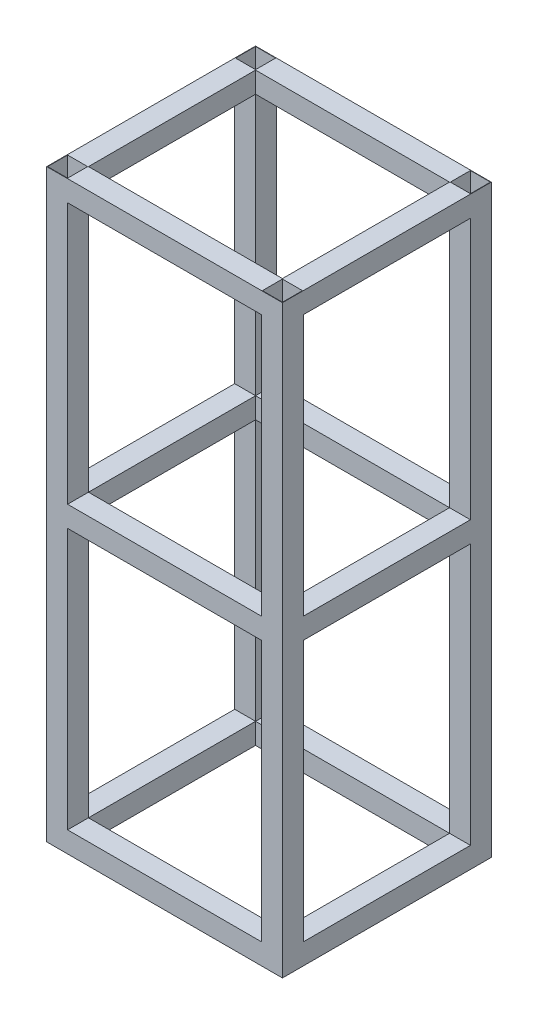
from build123d import *

# Parameters (mm, degrees)
BOSS_EXTRUDE1_START  = -2177.712701274
SKETCH1_W            = 155.425402548
SKETCH1_H            = 155.425402548
SKETCH1_W_2          = 149.425402548
SKETCH1_H_2          = 149.425402548
BOSS_EXTRUDE1_DEPTH  = 4355.425402548
BOSS_EXTRUDE2_START  = -2177.712701274
SKETCH2_W            = 155.425402548
SKETCH2_H            = 155.425402548
SKETCH2_W_2          = 149.425402548
SKETCH2_H_2          = 149.425402548
BOSS_EXTRUDE2_DEPTH  = 4355.425402548
BOSS_EXTRUDE3_START  = -2177.712701274
SKETCH3_W            = 155.425402548
SKETCH3_H            = 155.425402548
SKETCH3_W_2          = 149.425402548
SKETCH3_H_2          = 149.425402548
BOSS_EXTRUDE3_DEPTH  = 4355.425402548
BOSS_EXTRUDE4_START  = -2177.712701274
SKETCH4_W            = 155.425402548
SKETCH4_H            = 155.425402548
SKETCH4_W_2          = 149.425402548
SKETCH4_H_2          = 149.425402548
BOSS_EXTRUDE4_DEPTH  = 4355.425402548
BOSS_EXTRUDE5_START  = -722.287298726
SKETCH5_W            = 155.425402548
SKETCH5_H            = 155.425402548
SKETCH5_W_2          = 149.425402548
SKETCH5_H_2          = 149.425402548
BOSS_EXTRUDE5_DEPTH  = 1444.574597452
BOSS_EXTRUDE6_START  = -722.287298726
SKETCH6_W            = 155.425402548
SKETCH6_H            = 155.425402548
SKETCH6_W_2          = 149.425402548
SKETCH6_H_2          = 149.425402548
BOSS_EXTRUDE6_DEPTH  = 1444.574597452
BOSS_EXTRUDE7_START  = -622.287298726
SKETCH7_W            = 155.425402548
SKETCH7_H            = 155.425402548
SKETCH7_W_2          = 149.425402548
SKETCH7_H_2          = 149.425402548
BOSS_EXTRUDE7_DEPTH  = 1244.574597452
BOSS_EXTRUDE8_START  = -622.287298726
SKETCH8_W            = 155.425402548
SKETCH8_H            = 155.425402548
SKETCH8_W_2          = 149.425402548
SKETCH8_H_2          = 149.425402548
BOSS_EXTRUDE8_DEPTH  = 1244.574597452
BOSS_EXTRUDE9_START  = -722.287298726
SKETCH9_W            = 155.425402548
SKETCH9_H            = 155.425402548
SKETCH9_W_2          = 149.425402548
SKETCH9_H_2          = 149.425402548
BOSS_EXTRUDE9_DEPTH  = 1444.574597452
BOSS_EXTRUDE10_START = -722.287298726
SKETCH10_W           = 155.425402548
SKETCH10_H           = 155.425402548
SKETCH10_W_2         = 149.425402548
SKETCH10_H_2         = 149.425402548
BOSS_EXTRUDE10_DEPTH = 1444.574597452
BOSS_EXTRUDE11_START = -622.287298726
SKETCH11_W           = 155.425402548
SKETCH11_H           = 155.425402548
SKETCH11_W_2         = 149.425402548
SKETCH11_H_2         = 149.425402548
BOSS_EXTRUDE11_DEPTH = 1244.574597452
BOSS_EXTRUDE12_START = -622.287298726
SKETCH12_W           = 155.425402548
SKETCH12_H           = 155.425402548
SKETCH12_W_2         = 149.425402548
SKETCH12_H_2         = 149.425402548
BOSS_EXTRUDE12_DEPTH = 1244.574597452
BOSS_EXTRUDE13_START = -722.287298726
SKETCH13_W           = 155.425402548
SKETCH13_H           = 155.425402548
SKETCH13_W_2         = 149.425402548
SKETCH13_H_2         = 149.425402548
BOSS_EXTRUDE13_DEPTH = 1444.574597452
BOSS_EXTRUDE14_START = -722.287298726
SKETCH14_W           = 155.425402548
SKETCH14_H           = 155.425402548
SKETCH14_W_2         = 149.425402548
SKETCH14_H_2         = 149.425402548
BOSS_EXTRUDE14_DEPTH = 1444.574597452
BOSS_EXTRUDE15_START = -622.287298726
SKETCH15_W           = 155.425402548
SKETCH15_H           = 155.425402548
SKETCH15_W_2         = 149.425402548
SKETCH15_H_2         = 149.425402548
BOSS_EXTRUDE15_DEPTH = 1244.574597452
BOSS_EXTRUDE16_START = -622.287298726
SKETCH16_W           = 155.425402548
SKETCH16_H           = 155.425402548
SKETCH16_W_2         = 149.425402548
SKETCH16_H_2         = 149.425402548
BOSS_EXTRUDE16_DEPTH = 1244.574597452


with BuildPart() as part:
    # Sketch1 → Boss-Extrude1 (new body)
    with BuildSketch(Plane(origin=(0, 0, 0), x_dir=(1, 0, 0), z_dir=(0, 1, 0)).offset(BOSS_EXTRUDE1_START)):
        with Locations((-800, 700)):
            Rectangle(SKETCH1_W, SKETCH1_H)
        with Locations((-800, 700)):
            Rectangle(SKETCH1_W_2, SKETCH1_H_2, mode=Mode.SUBTRACT)
    extrude(amount=BOSS_EXTRUDE1_DEPTH)



with BuildPart() as body_2:
    # Sketch2 → Boss-Extrude2 (new body)
    with BuildSketch(Plane(origin=(0, 0, 0), x_dir=(1, 0, 0), z_dir=(0, 1, 0)).offset(BOSS_EXTRUDE2_START)):
        with Locations((-800, -700)):
            Rectangle(SKETCH2_W, SKETCH2_H)
        with Locations((-800, -700)):
            Rectangle(SKETCH2_W_2, SKETCH2_H_2, mode=Mode.SUBTRACT)
    extrude(amount=BOSS_EXTRUDE2_DEPTH)



with BuildPart() as body_3:
    # Sketch3 → Boss-Extrude3 (new body)
    with BuildSketch(Plane(origin=(0, 0, 0), x_dir=(1, 0, 0), z_dir=(0, 1, 0)).offset(BOSS_EXTRUDE3_START)):
        with Locations((800, 700)):
            Rectangle(SKETCH3_W, SKETCH3_H)
        with Locations((800, 700)):
            Rectangle(SKETCH3_W_2, SKETCH3_H_2, mode=Mode.SUBTRACT)
    extrude(amount=BOSS_EXTRUDE3_DEPTH)


with BuildPart() as body_4:
    # Sketch4 → Boss-Extrude4 (new body)
    with BuildSketch(Plane(origin=(0, 0, 0), x_dir=(1, 0, 0), z_dir=(0, 1, 0)).offset(BOSS_EXTRUDE4_START)):
        with Locations((800, -700)):
            Rectangle(SKETCH4_W, SKETCH4_H)
        with Locations((800, -700)):
            Rectangle(SKETCH4_W_2, SKETCH4_H_2, mode=Mode.SUBTRACT)
    extrude(amount=BOSS_EXTRUDE4_DEPTH)


with BuildPart() as part_1:
    add(part.part)

    add(body_3.part)  # Boss-Extrude5 merges body 3
    # Sketch5 → Boss-Extrude5 (add)
    with BuildSketch(Plane(origin=(0, 0, 0), x_dir=(0, 0, -1), z_dir=(1, 0, 0)).offset(BOSS_EXTRUDE5_START)):
        with Locations((700, -2100)):
            Rectangle(SKETCH5_W, SKETCH5_H)
        with Locations((700, -2100)):
            Rectangle(SKETCH5_W_2, SKETCH5_H_2, mode=Mode.SUBTRACT)
    extrude(amount=BOSS_EXTRUDE5_DEPTH)



with BuildPart() as body_2_1:
    add(body_2.part)

    add(body_4.part)  # Boss-Extrude6 merges body 4
    # Sketch6 → Boss-Extrude6 (add)
    with BuildSketch(Plane(origin=(0, 0, 0), x_dir=(0, 0, -1), z_dir=(1, 0, 0)).offset(BOSS_EXTRUDE6_START)):
        with Locations((-700, -2100)):
            Rectangle(SKETCH6_W, SKETCH6_H)
        with Locations((-700, -2100)):
            Rectangle(SKETCH6_W_2, SKETCH6_H_2, mode=Mode.SUBTRACT)
    extrude(amount=BOSS_EXTRUDE6_DEPTH)


with BuildPart() as part_2:
    add(part_1.part)

    add(body_2_1.part)  # Boss-Extrude7 merges body 2
    # Sketch7 → Boss-Extrude7 (add)
    with BuildSketch(Plane.XY.offset(BOSS_EXTRUDE7_START)):
        with Locations((-800, -2100)):
            Rectangle(SKETCH7_W, SKETCH7_H)
        with Locations((-800, -2100)):
            Rectangle(SKETCH7_W_2, SKETCH7_H_2, mode=Mode.SUBTRACT)
    extrude(amount=BOSS_EXTRUDE7_DEPTH)

    # Sketch8 → Boss-Extrude8 (add)
    with BuildSketch(Plane.XY.offset(BOSS_EXTRUDE8_START)):
        with Locations((800, -2100)):
            Rectangle(SKETCH8_W, SKETCH8_H)
        with Locations((800, -2100)):
            Rectangle(SKETCH8_W_2, SKETCH8_H_2, mode=Mode.SUBTRACT)
    extrude(amount=BOSS_EXTRUDE8_DEPTH)

    # Sketch9 → Boss-Extrude9 (add)
    with BuildSketch(Plane(origin=(0, 0, 0), x_dir=(0, 0, -1), z_dir=(1, 0, 0)).offset(BOSS_EXTRUDE9_START)):
        with Locations((700, 0)):
            Rectangle(SKETCH9_W, SKETCH9_H)
        with Locations((700, 0)):
            Rectangle(SKETCH9_W_2, SKETCH9_H_2, mode=Mode.SUBTRACT)
    extrude(amount=BOSS_EXTRUDE9_DEPTH)

    # Sketch10 → Boss-Extrude10 (add)
    with BuildSketch(Plane(origin=(0, 0, 0), x_dir=(0, 0, -1), z_dir=(1, 0, 0)).offset(BOSS_EXTRUDE10_START)):
        with Locations((-700, 0)):
            Rectangle(SKETCH10_W, SKETCH10_H)
        with Locations((-700, 0)):
            Rectangle(SKETCH10_W_2, SKETCH10_H_2, mode=Mode.SUBTRACT)
    extrude(amount=BOSS_EXTRUDE10_DEPTH)

    # Sketch11 → Boss-Extrude11 (add)
    with BuildSketch(Plane.XY.offset(BOSS_EXTRUDE11_START)):
        with Locations((-800, 0)):
            Rectangle(SKETCH11_W, SKETCH11_H)
        with Locations((-800, 0)):
            Rectangle(SKETCH11_W_2, SKETCH11_H_2, mode=Mode.SUBTRACT)
    extrude(amount=BOSS_EXTRUDE11_DEPTH)

    # Sketch12 → Boss-Extrude12 (add)
    with BuildSketch(Plane.XY.offset(BOSS_EXTRUDE12_START)):
        with Locations((800, 0)):
            Rectangle(SKETCH12_W, SKETCH12_H)
        with Locations((800, 0)):
            Rectangle(SKETCH12_W_2, SKETCH12_H_2, mode=Mode.SUBTRACT)
    extrude(amount=BOSS_EXTRUDE12_DEPTH)

    # Sketch13 → Boss-Extrude13 (add)
    with BuildSketch(Plane(origin=(0, 0, 0), x_dir=(0, 0, -1), z_dir=(1, 0, 0)).offset(BOSS_EXTRUDE13_START)):
        with Locations((700, 2100)):
            Rectangle(SKETCH13_W, SKETCH13_H)
        with Locations((700, 2100)):
            Rectangle(SKETCH13_W_2, SKETCH13_H_2, mode=Mode.SUBTRACT)
    extrude(amount=BOSS_EXTRUDE13_DEPTH)

    # Sketch14 → Boss-Extrude14 (add)
    with BuildSketch(Plane(origin=(0, 0, 0), x_dir=(0, 0, -1), z_dir=(1, 0, 0)).offset(BOSS_EXTRUDE14_START)):
        with Locations((-700, 2100)):
            Rectangle(SKETCH14_W, SKETCH14_H)
        with Locations((-700, 2100)):
            Rectangle(SKETCH14_W_2, SKETCH14_H_2, mode=Mode.SUBTRACT)
    extrude(amount=BOSS_EXTRUDE14_DEPTH)

    # Sketch15 → Boss-Extrude15 (add)
    with BuildSketch(Plane.XY.offset(BOSS_EXTRUDE15_START)):
        with Locations((-800, 2100)):
            Rectangle(SKETCH15_W, SKETCH15_H)
        with Locations((-800, 2100)):
            Rectangle(SKETCH15_W_2, SKETCH15_H_2, mode=Mode.SUBTRACT)
    extrude(amount=BOSS_EXTRUDE15_DEPTH)

    # Sketch16 → Boss-Extrude16 (add)
    with BuildSketch(Plane.XY.offset(BOSS_EXTRUDE16_START)):
        with Locations((800, 2100)):
            Rectangle(SKETCH16_W, SKETCH16_H)
        with Locations((800, 2100)):
            Rectangle(SKETCH16_W_2, SKETCH16_H_2, mode=Mode.SUBTRACT)
    extrude(amount=BOSS_EXTRUDE16_DEPTH)


solid = part_2.part
